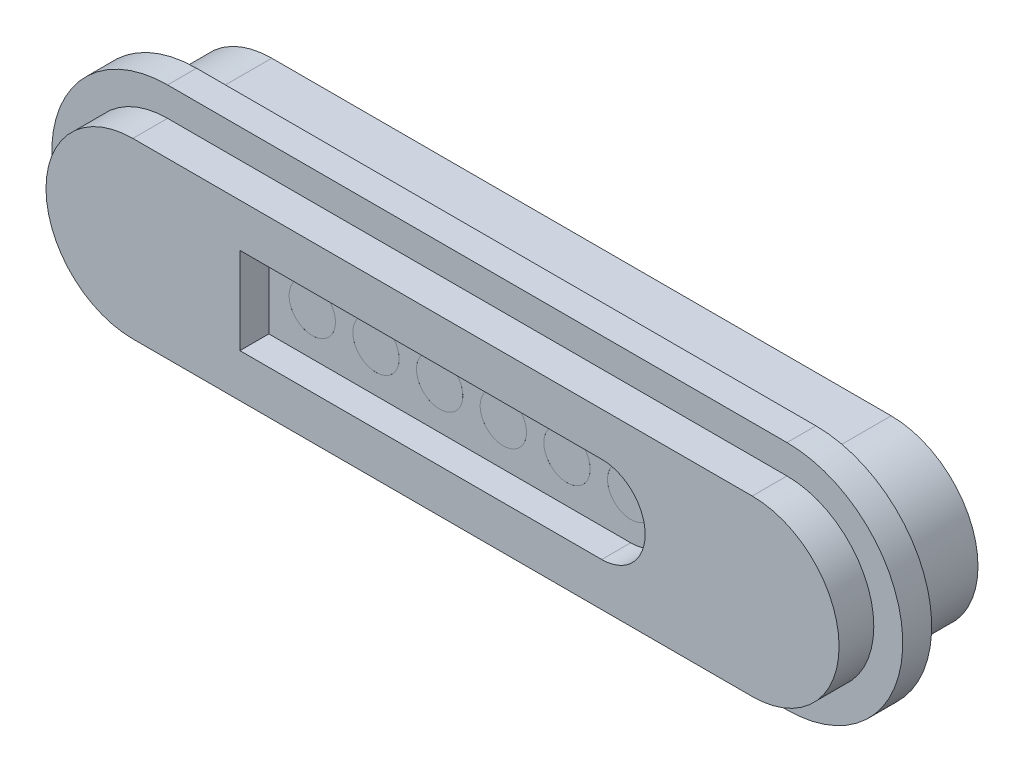
from build123d import *

# Parameters (mm, degrees)
BOSS_EXTRUDE1_DEPTH        = 4.8
SKETCH1_3_R                = 0.8
BOSS_EXTRUDE2_DEPTH        = 3.8
BOSS_EXTRUDE3_START        = 2.6
BOSS_EXTRUDE3_DEPTH        = 1
BOSS_EXTRUDE4_DEPTH        = 3.8
BOSS_EXTRUDE4_DEPTH_BACK   = 1.5
SKETCH1_5_R                = 0.8
BOSS_EXTRUDE4_2_DEPTH      = 3.8
BOSS_EXTRUDE4_2_DEPTH_BACK = 1.5
BOSS_EXTRUDE4_3_DEPTH      = 3.8
BOSS_EXTRUDE4_3_DEPTH_BACK = 1.5
BOSS_EXTRUDE4_4_DEPTH      = 3.8
BOSS_EXTRUDE4_4_DEPTH_BACK = 1.5
BOSS_EXTRUDE4_5_DEPTH      = 3.8
BOSS_EXTRUDE4_5_DEPTH_BACK = 1.5
BOSS_EXTRUDE4_6_DEPTH      = 3.8
BOSS_EXTRUDE4_6_DEPTH_BACK = 1.5


with BuildPart() as part:
    # Sketch1 → Boss-Extrude1 (new body)
    with BuildSketch(Plane.XY):
        with BuildLine():
            Line((11.084370489, 2.339660796), (-10.315629511, 2.339660796))
            ThreePointArc((-10.315629511, 2.339660796), (-13.315629511, -0.660339204), (-10.315629511, -3.660339204))
            Line((-10.315629511, -3.660339204), (11.084370489, -3.660339204))
            ThreePointArc((11.084370489, -3.660339204), (14.084370489, -0.660339204), (11.084370489, 2.339660796))
        make_face()
        with BuildLine():
            ThreePointArc((5.898308619, 0.839596037), (7.384354299, -0.667308526), (5.884370126, -2.160339204))
            Line((5.884370126, -2.160339204), (-6.615645701, -2.16033618))
            Line((-6.615645701, -2.16033618), (-6.615645701, 0.839596037))
            Line((-6.615645701, 0.839596037), (5.898308619, 0.839596037))
        make_face(mode=Mode.SUBTRACT)
    extrude(amount=BOSS_EXTRUDE1_DEPTH)

    # Sketch1<3> → Boss-Extrude2 (add)
    with BuildSketch(Plane.XY):
        with BuildLine():
            Line((-6.615645701, -2.16033618), (5.884370126, -2.160339204))
            ThreePointArc((5.884370126, -2.160339204), (7.384354299, -0.667308526), (5.898308619, 0.839596037))
            Line((5.898308619, 0.839596037), (-6.615645701, 0.839596037))
            Line((-6.615645701, 0.839596037), (-6.615645701, -2.16033618))
        make_face()
        with Locations((-5.115629511, -0.660339204)):
            Circle(SKETCH1_3_R, mode=Mode.SUBTRACT)
        with Locations((-2.915629511, -0.660339204)):
            Circle(SKETCH1_3_R, mode=Mode.SUBTRACT)
        with Locations((-0.715629511, -0.660339204)):
            Circle(SKETCH1_3_R, mode=Mode.SUBTRACT)
        with Locations((1.484370489, -0.660339204)):
            Circle(SKETCH1_3_R, mode=Mode.SUBTRACT)
        with Locations((3.684370489, -0.660339204)):
            Circle(SKETCH1_3_R, mode=Mode.SUBTRACT)
        with Locations((5.884370489, -0.660339204)):
            Circle(SKETCH1_3_R, mode=Mode.SUBTRACT)
    extrude(amount=BOSS_EXTRUDE2_DEPTH)

    # Sketch1<4> → Boss-Extrude3 (add)
    with BuildSketch(Plane.XY.offset(BOSS_EXTRUDE3_START)):
        with BuildLine():
            Line((11.084370489, 3.339660796), (-10.315629511, 3.339660796))
            ThreePointArc((-10.315629511, 3.339660796), (-14.315629511, -0.660339204), (-10.315629511, -4.660339204))
            Line((-10.315629511, -4.660339204), (11.084370489, -4.660339204))
            ThreePointArc((11.084370489, -4.660339204), (15.084370489, -0.660339204), (11.084370489, 3.339660796))
        make_face()
        with BuildLine():
            ThreePointArc((-10.315629511, -3.660339204), (-13.315629511, -0.660339204), (-10.315629511, 2.339660796))
            Line((-10.315629511, 2.339660796), (11.084370489, 2.339660796))
            ThreePointArc((11.084370489, 2.339660796), (14.084370489, -0.660339204), (11.084370489, -3.660339204))
            Line((11.084370489, -3.660339204), (-10.315629511, -3.660339204))
        make_face(mode=Mode.SUBTRACT)
    extrude(amount=BOSS_EXTRUDE3_DEPTH)


with BuildPart() as body_2:
    # Sketch1<5> → Boss-Extrude4 (new, two sides: drawn at the far end of the back side and taken through both)
    with BuildSketch(Plane.XY.offset(-BOSS_EXTRUDE4_DEPTH_BACK)):
        with Locations((1.484370489, -0.660339204)):
            Circle(SKETCH1_5_R)
    extrude(amount=BOSS_EXTRUDE4_DEPTH + BOSS_EXTRUDE4_DEPTH_BACK)


with BuildPart() as body_3:
    # Sketch1<5> → Boss-Extrude4 2 (new, two sides: drawn at the far end of the back side and taken through both)
    with BuildSketch(Plane.XY.offset(-BOSS_EXTRUDE4_2_DEPTH_BACK)):
        with Locations((3.684370489, -0.660339204)):
            Circle(SKETCH1_5_R)
    extrude(amount=BOSS_EXTRUDE4_2_DEPTH + BOSS_EXTRUDE4_2_DEPTH_BACK)


with BuildPart() as body_4:
    # Sketch1<5> → Boss-Extrude4 3 (new, two sides: drawn at the far end of the back side and taken through both)
    with BuildSketch(Plane.XY.offset(-BOSS_EXTRUDE4_3_DEPTH_BACK)):
        with Locations((5.884370489, -0.660339204)):
            Circle(SKETCH1_5_R)
    extrude(amount=BOSS_EXTRUDE4_3_DEPTH + BOSS_EXTRUDE4_3_DEPTH_BACK)


with BuildPart() as body_5:
    # Sketch1<5> → Boss-Extrude4 4 (new, two sides: drawn at the far end of the back side and taken through both)
    with BuildSketch(Plane.XY.offset(-BOSS_EXTRUDE4_4_DEPTH_BACK)):
        with Locations((-5.115629511, -0.660339204)):
            Circle(SKETCH1_5_R)
    extrude(amount=BOSS_EXTRUDE4_4_DEPTH + BOSS_EXTRUDE4_4_DEPTH_BACK)


with BuildPart() as body_6:
    # Sketch1<5> → Boss-Extrude4 5 (new, two sides: drawn at the far end of the back side and taken through both)
    with BuildSketch(Plane.XY.offset(-BOSS_EXTRUDE4_5_DEPTH_BACK)):
        with Locations((-2.915629511, -0.660339204)):
            Circle(SKETCH1_5_R)
    extrude(amount=BOSS_EXTRUDE4_5_DEPTH + BOSS_EXTRUDE4_5_DEPTH_BACK)


with BuildPart() as body_7:
    # Sketch1<5> → Boss-Extrude4 6 (new, two sides: drawn at the far end of the back side and taken through both)
    with BuildSketch(Plane.XY.offset(-BOSS_EXTRUDE4_6_DEPTH_BACK)):
        with Locations((-0.715629511, -0.660339204)):
            Circle(SKETCH1_5_R)
    extrude(amount=BOSS_EXTRUDE4_6_DEPTH + BOSS_EXTRUDE4_6_DEPTH_BACK)


solid = Compound([part.part, body_2.part, body_3.part, body_4.part, body_5.part, body_6.part, body_7.part])
